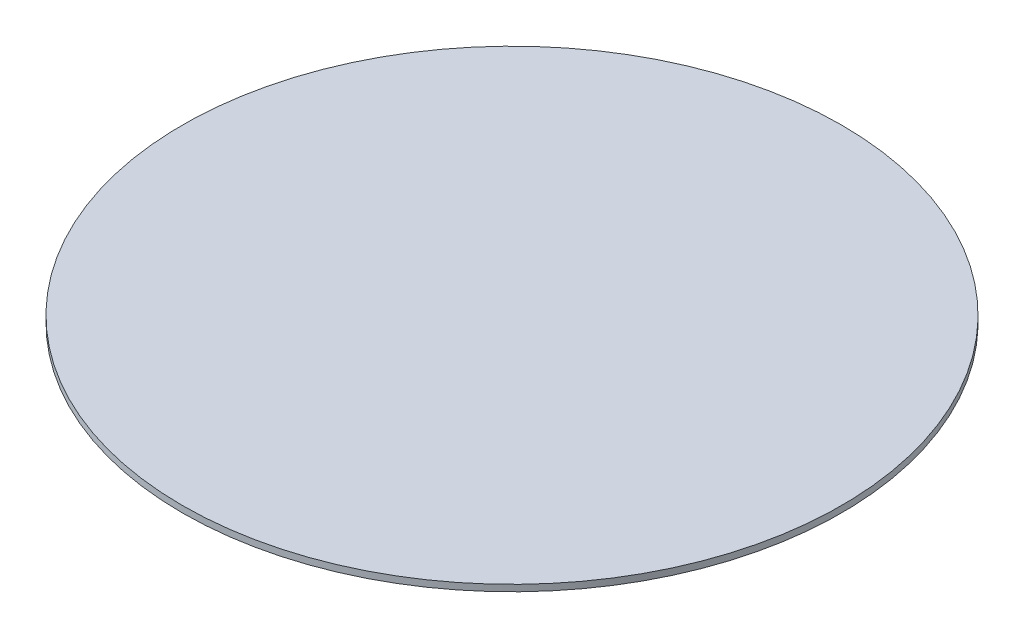
from build123d import *

# Parameters (mm, degrees)
SKETCH1_R           = 161.5
BOSS_EXTRUDE1_DEPTH = 3.175


with BuildPart() as part:
    # Sketch1 → Boss-Extrude1 (new body)
    with BuildSketch(Plane(origin=(0, 0, 0), x_dir=(1, 0, 0), z_dir=(0, 1, 0))):
        with Locations(Location((0, 0, 0), (0, 0, 270))):
            Circle(SKETCH1_R)
    extrude(amount=BOSS_EXTRUDE1_DEPTH)


solid = part.part
